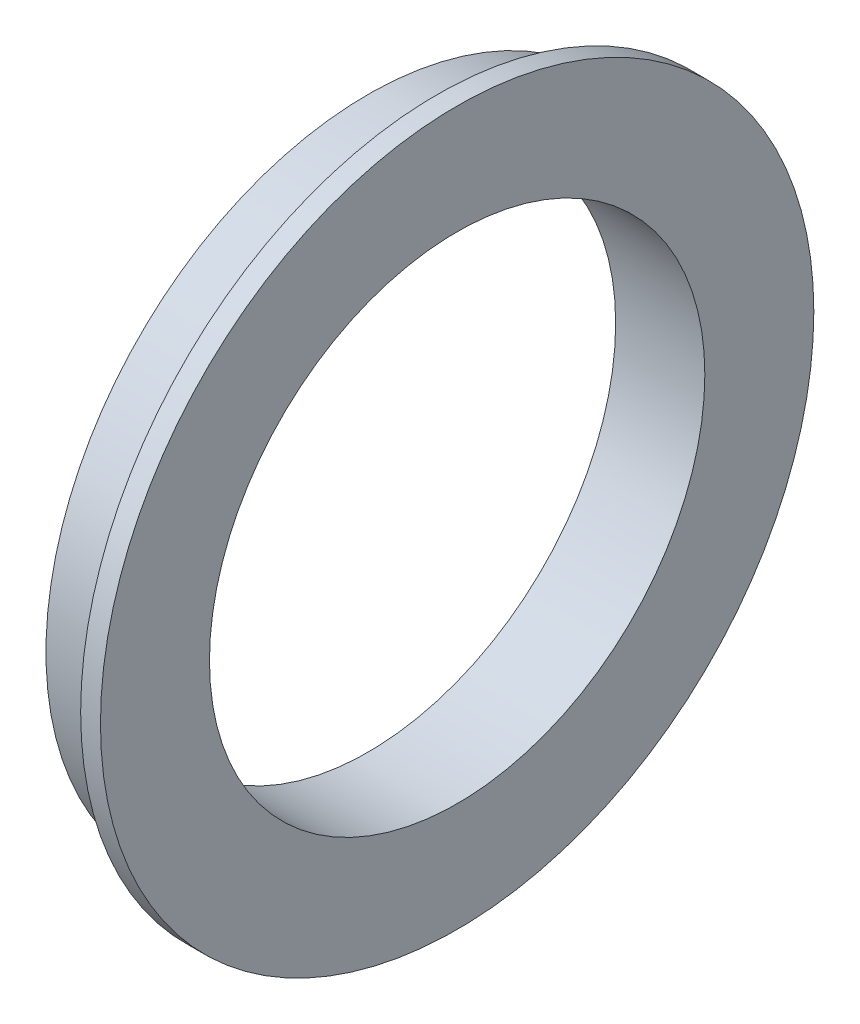
from build123d import *

# Parameters (mm, degrees)
SKETCH1_R           = 32.5
SKETCH1_R_2         = 25
BOSS_EXTRUDE1_DEPTH = 7
SKETCH2_R           = 36
SKETCH2_R_2         = 25
BOSS_EXTRUDE2_DEPTH = 2


with BuildPart() as part:
    # Sketch1 → Boss-Extrude1 (new body)
    with BuildSketch(Plane(origin=(0, 0, 0), x_dir=(0, 0, -1), z_dir=(1, 0, 0))):
        Circle(SKETCH1_R)
        Circle(SKETCH1_R_2, mode=Mode.SUBTRACT)
    extrude(amount=BOSS_EXTRUDE1_DEPTH)

    # Sketch2 → Boss-Extrude2 (add)
    with BuildSketch(Plane(origin=(7, 0, 0), x_dir=(0, 0, -1), z_dir=(1, 0, 0))):
        Circle(SKETCH2_R)
        Circle(SKETCH2_R_2, mode=Mode.SUBTRACT)
    extrude(amount=BOSS_EXTRUDE2_DEPTH)


solid = part.part
